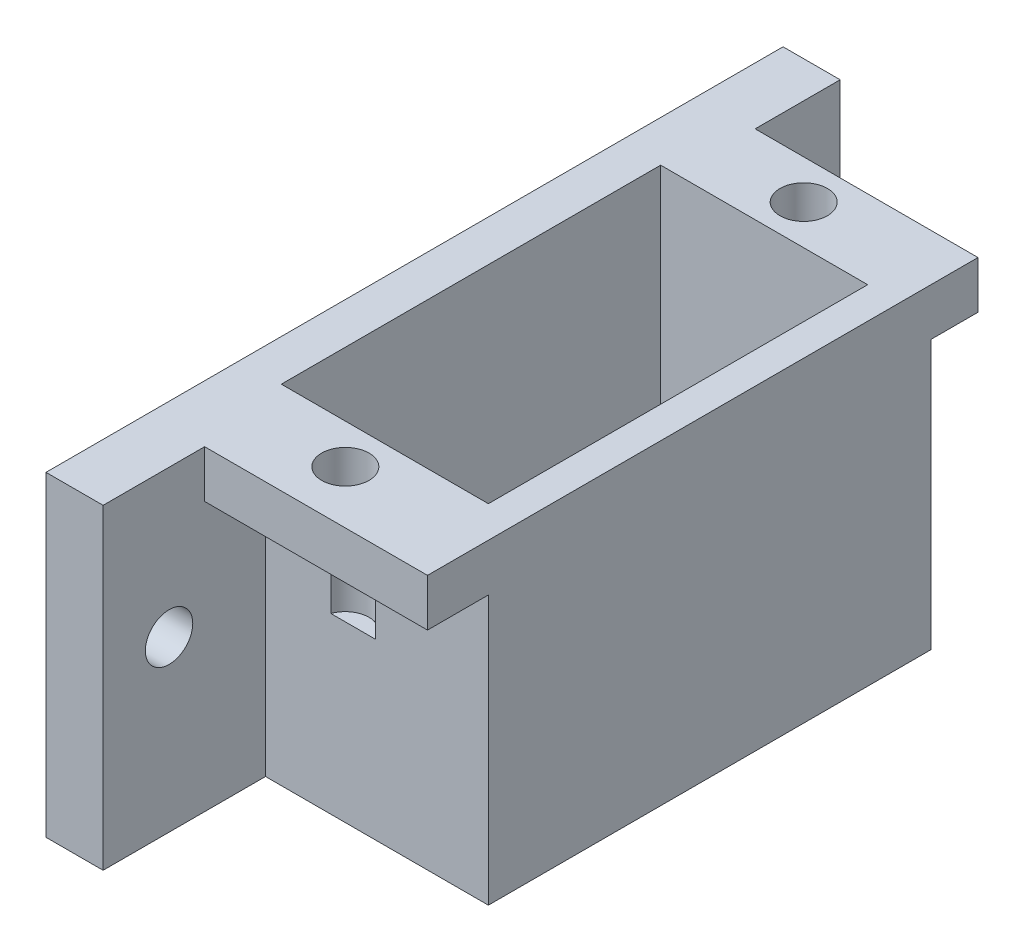
from build123d import *

# Parameters (mm, degrees)
SKETCH1_W               = 13.1
SKETCH1_H               = 24
BOSS_EXTRUDE1_DEPTH     = 20
CUT_EXTRUDE1_DEPTH      = 37.333765723
CUT_EXTRUDE1_DEPTH_BACK = 37.333765723
SKETCH4_R               = 1.5
BOSS_EXTRUDE2_START     = 17
BOSS_EXTRUDE2_DEPTH     = 3
BOSS_EXTRUDE3_DEPTH     = 11


with BuildPart() as part:
    # Sketch1 → Boss-Extrude1 (new body)
    with BuildSketch(Plane(origin=(0, 0, 0), x_dir=(1, 0, 0), z_dir=(0, 1, 0))):
        with BuildLine():
            Line((51.803705275, -9.5), (51.803705275, 18.5))
            Line((51.803705275, 18.5), (44.667918837, 18.5))
            ThreePointArc((44.667918837, 18.5), (43.253705275, 17.5), (41.839491713, 18.5))
            Line((41.839491713, 18.5), (37.703705275, 18.5))
            Line((37.703705275, 18.5), (37.703705275, 26.857634512))
            Line((37.703705275, 26.857634512), (34.090699836, 26.857634512))
            Line((34.090699836, 26.857634512), (34.090699836, -19.776172663))
            Line((34.090699836, -19.776172663), (37.703705275, -19.776172663))
            Line((37.703705275, -19.776172663), (37.703705275, -9.5))
            Line((37.703705275, -9.5), (41.839491713, -9.5))
            ThreePointArc((41.839491713, -9.5), (43.253705275, -8.5), (44.667918837, -9.5))
            Line((44.667918837, -9.5), (51.803705275, -9.5))
        make_face()
        with Locations((43.253705275, 4.5)):
            Rectangle(SKETCH1_W, SKETCH1_H, mode=Mode.SUBTRACT)
    extrude(amount=BOSS_EXTRUDE1_DEPTH)

    # Sketch4 → Cut-Extrude1 (cut, two sides: drawn at the far end of the back side and taken through both)
    with BuildSketch(Plane(origin=(37.703705275, 0, 0), x_dir=(0, 0, -1), z_dir=(1, 0, 0)).offset(-CUT_EXTRUDE1_DEPTH_BACK)):
        with Locations((-15.603546026, 10.694249846)):
            Circle(SKETCH4_R)
        with Locations(Location((22.568421885, 10.286160732, 0), (0, 0, 180))):
            Circle(SKETCH4_R)
    extrude(amount=CUT_EXTRUDE1_DEPTH + CUT_EXTRUDE1_DEPTH_BACK, mode=Mode.SUBTRACT)

    # Sketch1<31> → Boss-Extrude2 (add)
    with BuildSketch(Plane(origin=(0, 0, 0), x_dir=(1, 0, 0), z_dir=(0, 1, 0)).offset(BOSS_EXTRUDE2_START)):
        with BuildLine():
            Line((51.803705275, -13.351943518), (51.803705275, -9.5))
            Line((51.803705275, -9.5), (44.667918837, -9.5))
            ThreePointArc((44.667918837, -9.5), (44.732103114, -9.746347032), (44.753705275, -10))
            ThreePointArc((44.753705275, -10), (44.314365447, -11.060660172), (43.253705275, -11.5))
            Line((43.253705275, -11.5), (43.253705275, -13.351943518))
            Line((43.253705275, -13.351943518), (51.803705275, -13.351943518))
        make_face()
        with BuildLine():
            Line((37.703705275, -13.351943518), (43.253705275, -13.351943518))
            Line((43.253705275, -13.351943518), (43.253705275, -11.5))
            ThreePointArc((43.253705275, -11.5), (42.028960404, -10.866025404), (41.839491713, -9.5))
            Line((41.839491713, -9.5), (37.703705275, -9.5))
            Line((37.703705275, -9.5), (37.703705275, -13.351943518))
        make_face()
        with BuildLine():
            Line((44.667918837, 18.5), (51.803705275, 18.5))
            Line((51.803705275, 18.5), (51.803705275, 21.478401139))
            Line((51.803705275, 21.478401139), (43.253705275, 21.478401139))
            Line((43.253705275, 21.478401139), (43.253705275, 20.5))
            ThreePointArc((43.253705275, 20.5), (44.314365447, 20.060660172), (44.753705275, 19))
            ThreePointArc((44.753705275, 19), (44.732103114, 18.746347032), (44.667918837, 18.5))
        make_face()
        with BuildLine():
            Line((43.253705275, 20.5), (43.253705275, 21.478401139))
            Line((43.253705275, 21.478401139), (37.703705275, 21.478401139))
            Line((37.703705275, 21.478401139), (37.703705275, 18.5))
            Line((37.703705275, 18.5), (41.839491713, 18.5))
            ThreePointArc((41.839491713, 18.5), (42.028960404, 19.866025404), (43.253705275, 20.5))
        make_face()
    extrude(amount=BOSS_EXTRUDE2_DEPTH)

    # Sketch1<32> → Boss-Extrude3 (add)
    with BuildSketch(Plane(origin=(0, 0, 0), x_dir=(1, 0, 0), z_dir=(0, 1, 0))):
        with BuildLine():
            Line((44.667918837, 18.5), (41.839491713, 18.5))
            ThreePointArc((41.839491713, 18.5), (43.253705275, 17.5), (44.667918837, 18.5))
        make_face()
        with BuildLine():
            ThreePointArc((44.667918837, -9.5), (43.253705275, -8.5), (41.839491713, -9.5))
            Line((41.839491713, -9.5), (44.667918837, -9.5))
        make_face()
    extrude(amount=BOSS_EXTRUDE3_DEPTH)


solid = part.part
